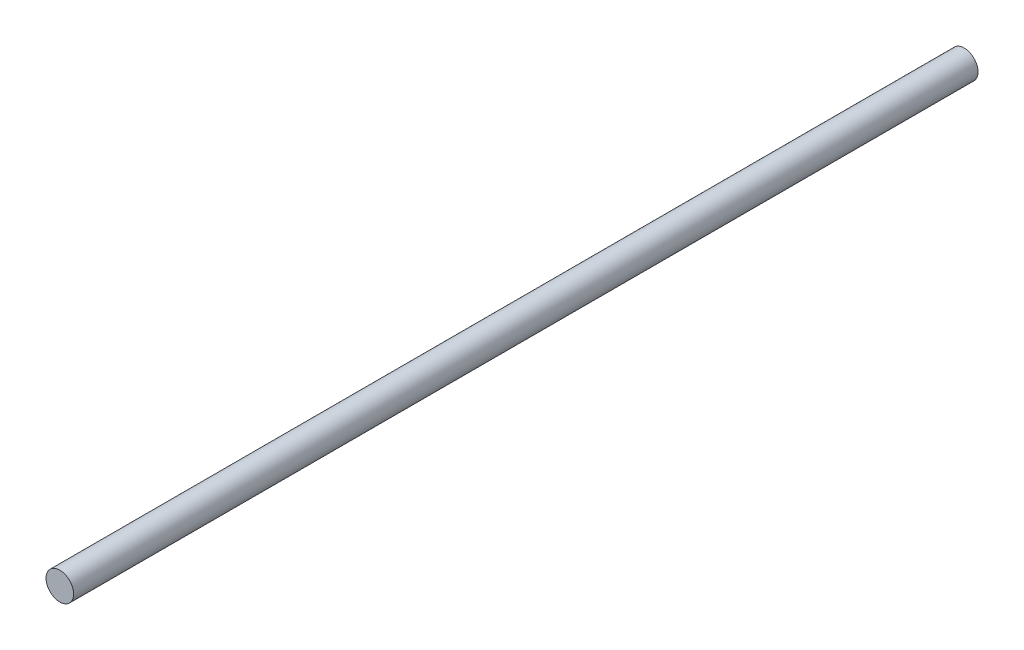
from build123d import *

# Parameters (mm, degrees)
SKETCH1_R           = 6.35
BOSS_EXTRUDE1_DEPTH = 415.925


with BuildPart() as part:
    # Sketch1 → Boss-Extrude1 (new body)
    with BuildSketch(Plane.XY):
        with Locations(Location((0, 0, 0), (0, 0, 180))):
            Circle(SKETCH1_R)
    extrude(amount=BOSS_EXTRUDE1_DEPTH)


solid = part.part
